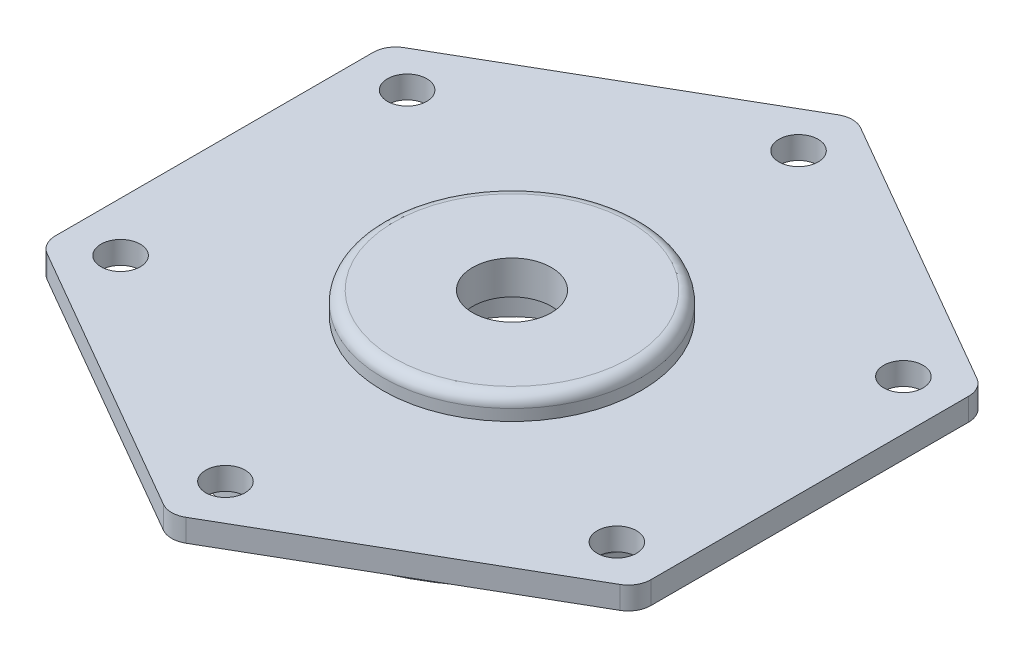
from build123d import *

# Parameters (mm, degrees)
BOSS_EXTRUDE1_DEPTH = 4
SKETCH2_R           = 23
BOSS_EXTRUDE2_DEPTH = 4
SKETCH3_R           = 45
BOSS_EXTRUDE3_DEPTH = 6
SKETCH4_R           = 40
SKETCH4_R_2         = 19
CUT_EXTRUDE1_DEPTH  = 6
SKETCH5_R           = 14
CUT_EXTRUDE2_DEPTH  = 8
SKETCH6_R           = 7
CUT_EXTRUDE3_DEPTH  = 81.888663881
FILLET1_R           = 2
SKETCH7_R           = 3.5
CUT_EXTRUDE4_DEPTH  = 82.110886719


with BuildPart() as part:
    # Sketch1 → Boss-Extrude1 (new body)
    with BuildSketch(Plane(origin=(0, 0, 0), x_dir=(1, 0, 0), z_dir=(0, 1, 0))):
        with BuildLine():
            Line((2, -60.044427996), (51, -31.754264805))
            ThreePointArc((51, -31.754264805), (52.464101615, -30.29016319), (53, -28.29016319))
            Line((53, -28.29016319), (53, 28.29016319))
            ThreePointArc((53, 28.29016319), (52.464101615, 30.29016319), (51, 31.754264805))
            Line((51, 31.754264805), (2, 60.044427996))
            ThreePointArc((2, 60.044427996), (0, 60.580326381), (-2, 60.044427996))
            Line((-2, 60.044427996), (-51, 31.754264805))
            ThreePointArc((-51, 31.754264805), (-52.464101615, 30.29016319), (-53, 28.29016319))
            Line((-53, 28.29016319), (-53, -28.29016319))
            ThreePointArc((-53, -28.29016319), (-52.464101615, -30.29016319), (-51, -31.754264805))
            Line((-51, -31.754264805), (-2, -60.044427996))
            ThreePointArc((-2, -60.044427996), (0, -60.580326381), (2, -60.044427996))
        make_face()
    extrude(amount=BOSS_EXTRUDE1_DEPTH)

    # Sketch2 → Boss-Extrude2 (add)
    with BuildSketch(Plane(origin=(0, 4, 0), x_dir=(1, 0, 0), z_dir=(0, 1, 0))):
        with Locations(Location((0, 0, 0), (0, 0, 270))):
            Circle(SKETCH2_R)
    extrude(amount=BOSS_EXTRUDE2_DEPTH)

    # Sketch3 → Boss-Extrude3 (add)
    with BuildSketch(Plane.XZ):
        with Locations(Location((0, 0, 0), (0, 0, 270))):
            Circle(SKETCH3_R)
    extrude(amount=BOSS_EXTRUDE3_DEPTH)

    # Sketch4 → Cut-Extrude1 (cut)
    with BuildSketch(Plane.XZ.offset(6)):
        with Locations(Location((0, 0, 0), (0, 0, 270))):
            Circle(SKETCH4_R)
        with Locations(Location((0, 0, 0), (0, 0, 270))):
            Circle(SKETCH4_R_2, mode=Mode.SUBTRACT)
    extrude(amount=-CUT_EXTRUDE1_DEPTH, mode=Mode.SUBTRACT)

    # Sketch5 → Cut-Extrude2 (cut)
    with BuildSketch(Plane.XZ.offset(6)):
        with Locations(Location((0, 0, 0), (0, 0, 270))):
            Circle(SKETCH5_R)
    extrude(amount=-CUT_EXTRUDE2_DEPTH, mode=Mode.SUBTRACT)

    # Sketch6 → Cut-Extrude3 (cut, through all)
    with BuildSketch(Plane.XZ.offset(-2)):
        with Locations(Location((0, 0, 0), (0, 0, 270))):
            Circle(SKETCH6_R)
    extrude(amount=-CUT_EXTRUDE3_DEPTH, mode=Mode.SUBTRACT)

    # Fillet1
    fillet1_edges = [part.edges().sort_by_distance(p)[0] for p in [
        (0, 8, -23),
        (0, 0, 45),
        (0, -6, 19),
    ]]
    fillet(fillet1_edges, radius=FILLET1_R)

    # Sketch7 → Cut-Extrude4 (cut, through all)
    with BuildSketch(Plane(origin=(0, 4, 0), x_dir=(1, 0, 0), z_dir=(0, 1, 0))):
        with Locations(Location((0, 51, 0), (0, 0, 270))):
            Circle(SKETCH7_R)
        with Locations(Location((44.167295593, 25.5, 0), (0, 0, 270))):
            Circle(SKETCH7_R)
        with Locations(Location((44.167295593, -25.5, 0), (0, 0, 270))):
            Circle(SKETCH7_R)
        with Locations(Location((0, -51, 0), (0, 0, 270))):
            Circle(SKETCH7_R)
        with Locations(Location((-44.167295593, -25.5, 0), (0, 0, 270))):
            Circle(SKETCH7_R)
        with Locations(Location((-44.167295593, 25.5, 0), (0, 0, 270))):
            Circle(SKETCH7_R)
    extrude(amount=-CUT_EXTRUDE4_DEPTH, mode=Mode.SUBTRACT)


solid = part.part
